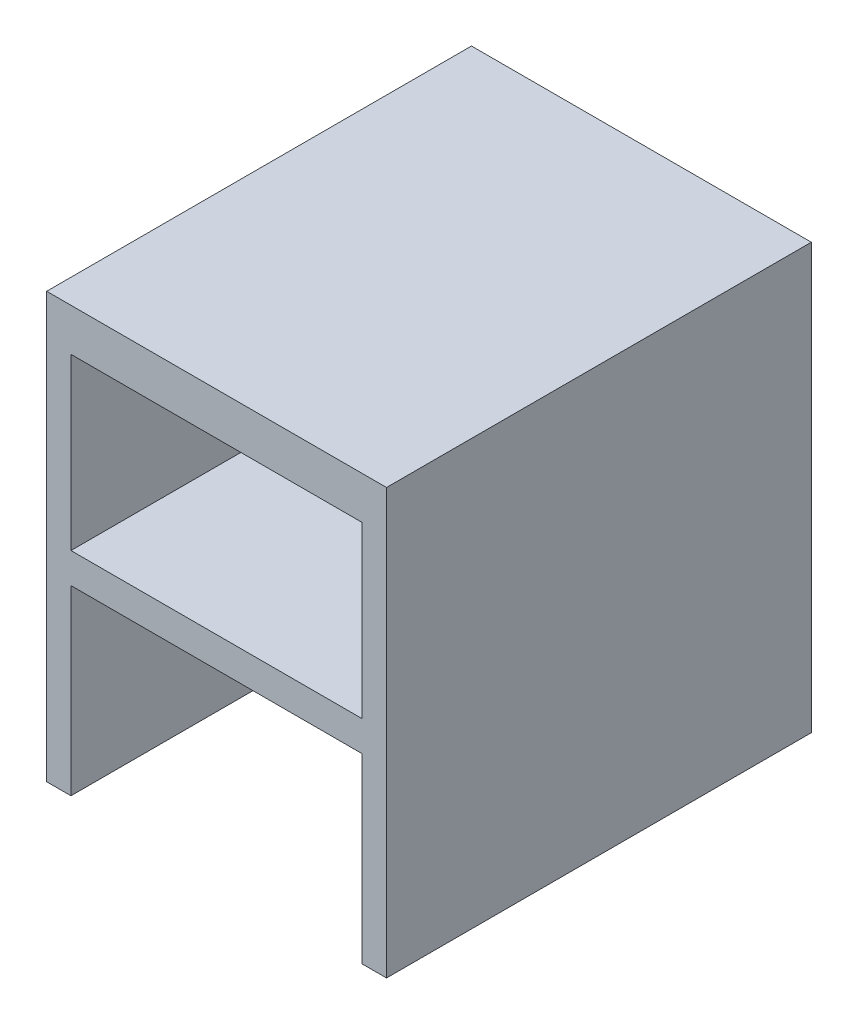
from build123d import *

# Parameters (mm, degrees)
SKETCH1_W           = 48
SKETCH1_H           = 5
BOSS_EXTRUDE1_DEPTH = 70


with BuildPart() as part:
    # Sketch1 → Boss-Extrude1 (new body)
    with BuildSketch(Plane.XY):
        Polygon((4, 0), (0, 0), (0, 70), (56, 70), (56, 0), (52, 0), (52, 63), (4, 63), align=None)
        with Locations((28, 32.5)):
            Rectangle(SKETCH1_W, SKETCH1_H)
    extrude(amount=BOSS_EXTRUDE1_DEPTH)


solid = part.part
